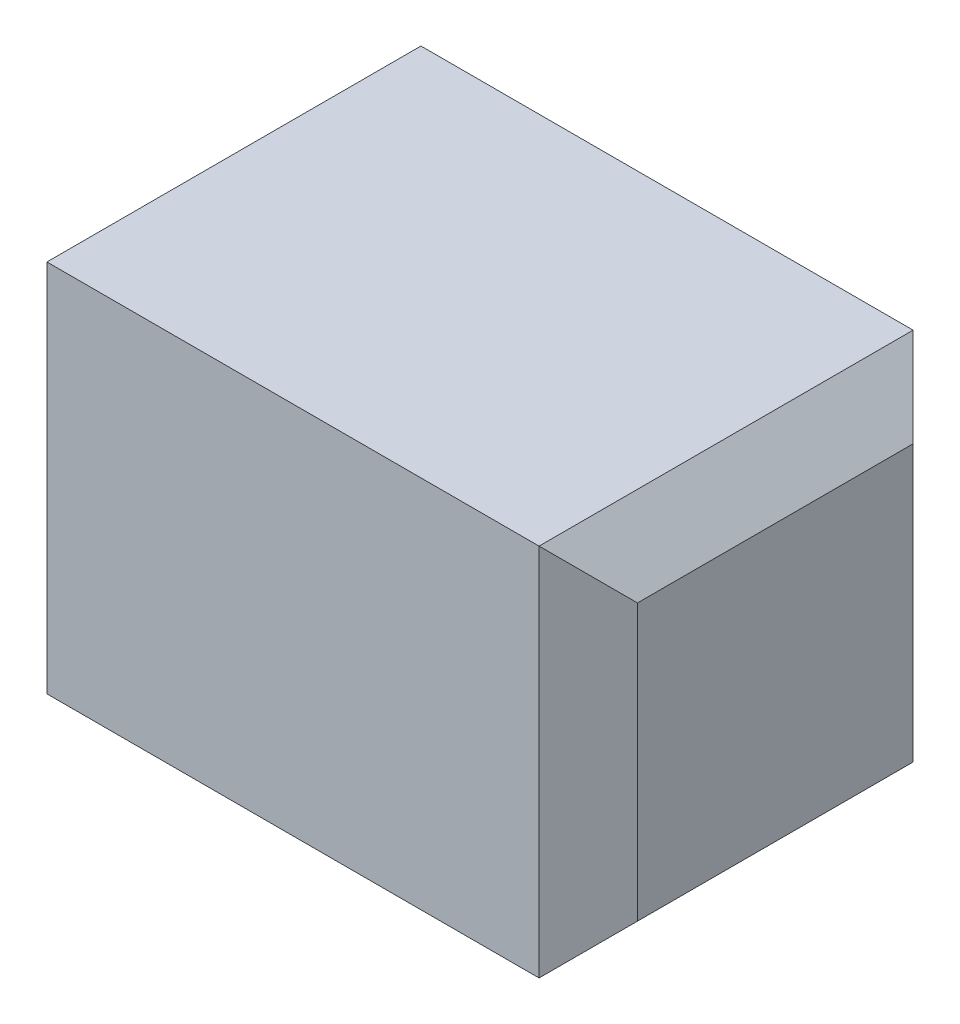
from build123d import *

# Parameters (mm, degrees)
SKETCH1_W           = 6
SKETCH1_H           = 3.8
BOSS_EXTRUDE1_DEPTH = 3.8
CHAMFER1_SIZE       = 0.5


with BuildPart() as part:
    # Sketch1 → Boss-Extrude1 (new body)
    with BuildSketch(Plane(origin=(0, 0, 0), x_dir=(1, 0, 0), z_dir=(0, 1, 0))):
        Rectangle(SKETCH1_W, SKETCH1_H)
    extrude(amount=BOSS_EXTRUDE1_DEPTH)

    # Chamfer1
    chamfer1_edges = [part.edges().sort_by_distance(p)[0] for p in [
        (-3, 3.8, 0),
        (3, 3.8, 0),
        (-3, 0, 0),
        (3, 0, 0),
        (3, 1.9, 1.9),
        (-3, 1.9, 1.9),
        (-3, 1.9, -1.9),
        (3, 1.9, -1.9),
    ]]
    chamfer(chamfer1_edges, length=CHAMFER1_SIZE)


solid = part.part
